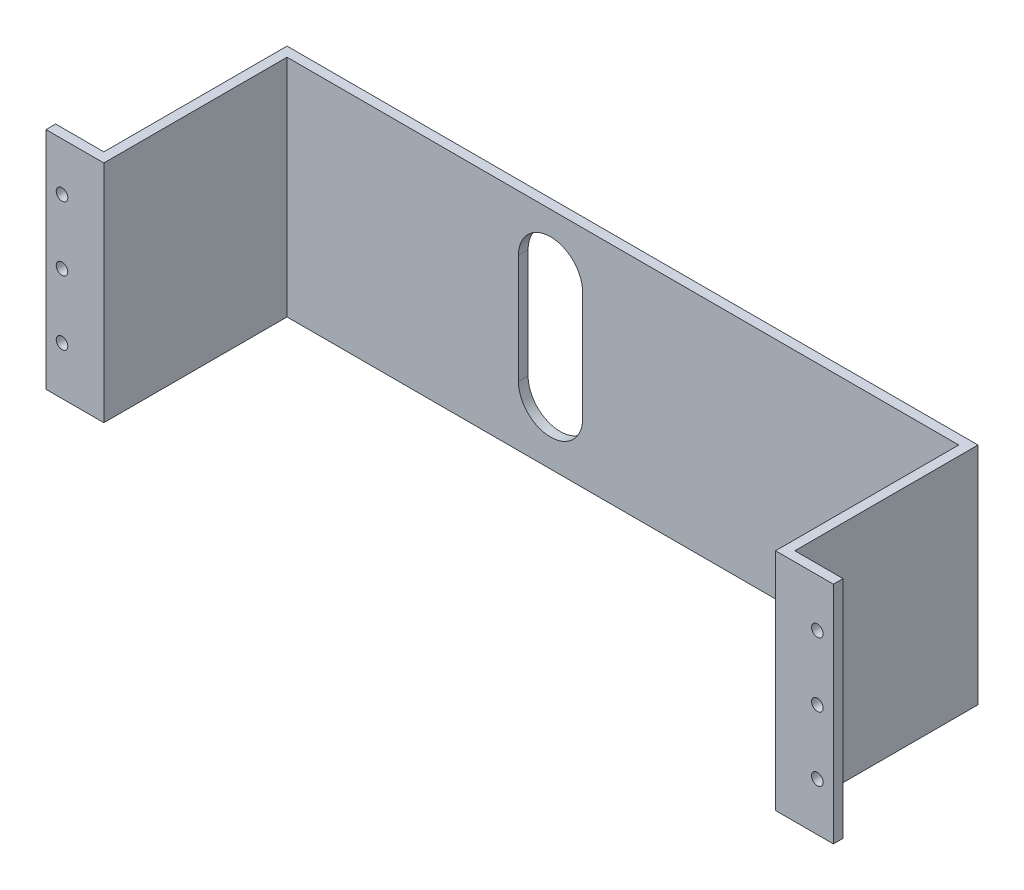
from build123d import *

# Parameters (mm, degrees)
BOSS_EXTRUDE1_DEPTH = 70
SKETCH2_R           = 1.8
CUT_EXTRUDE1_DEPTH  = 262.101512826
CUT_EXTRUDE2_REACH  = 263.102


with BuildPart() as part:
    # Sketch1 → Boss-Extrude1 (new body)
    with BuildSketch(Plane(origin=(0, 0, 0), x_dir=(1, 0, 0), z_dir=(0, 1, 0))):
        Polygon((0, 0), (18, 0), (18, 57), (227, 57), (227, 0), (245, 0), (245, 3), (230, 3), (230, 60), (15, 60), (15, 3), (0, 3), align=None)
    extrude(amount=BOSS_EXTRUDE1_DEPTH)

    # Sketch2 → Cut-Extrude1 (cut, through all)
    with BuildSketch(Plane(origin=(0, 0, -3), x_dir=(-1, 0, 0), z_dir=(0, 0, -1))):
        with Locations((-240.02, 55)):
            Circle(SKETCH2_R)
        with Locations((-240.02, 35)):
            Circle(SKETCH2_R)
        with Locations((-240.02, 15)):
            Circle(SKETCH2_R)
        with Locations((-4.98, 15)):
            Circle(SKETCH2_R)
        with Locations((-4.98, 35)):
            Circle(SKETCH2_R)
        with Locations((-4.98, 55)):
            Circle(SKETCH2_R)
    extrude(amount=-CUT_EXTRUDE1_DEPTH, mode=Mode.SUBTRACT)

    # Sketch3 → Cut-Extrude2 (cut, up to next)
    with BuildSketch(Plane.XY.offset(-57), mode=Mode.PRIVATE) as cut_extrude2_sk1:
        with BuildLine():
            Line((110, 52.616114621), (110, 18.63325521))
            ThreePointArc((110, 18.63325521), (100, 8.63325521), (90, 18.63325521))
            Line((90, 18.63325521), (90, 52.616114621))
            ThreePointArc((90, 52.616114621), (100, 62.616114621), (110, 52.616114621))
        make_face()
    cut_extrude2_tool1 = extrude(cut_extrude2_sk1.sketch, amount=-CUT_EXTRUDE2_REACH, mode=Mode.PRIVATE) & part.part
    add(cut_extrude2_tool1.solids().sort_by_distance((100, 35.624685, -57))[0], mode=Mode.SUBTRACT)


solid = part.part
